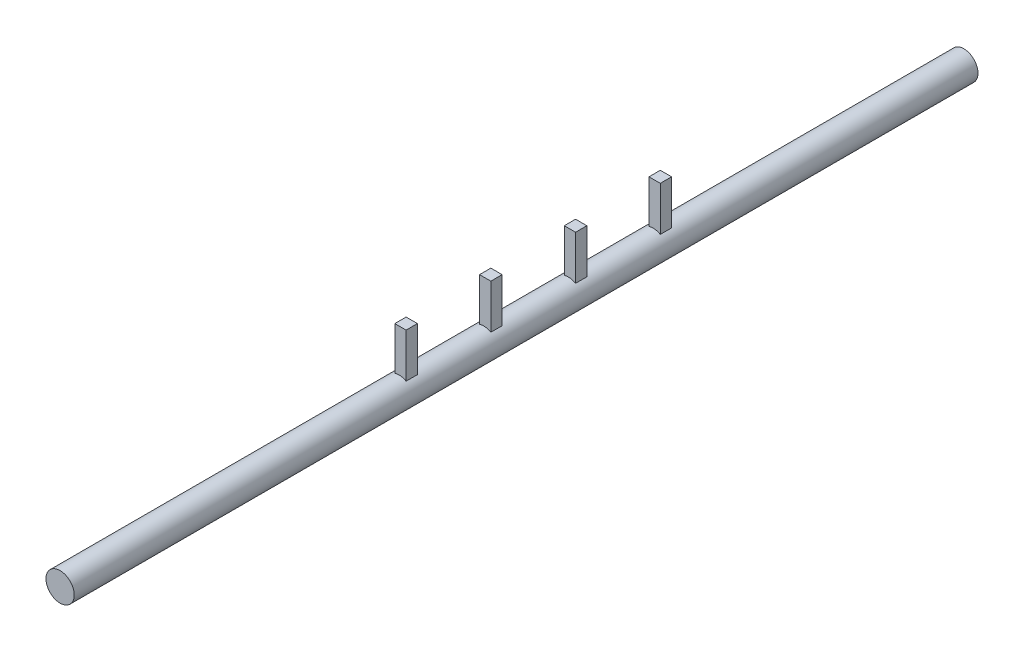
from build123d import *

# Parameters (mm, degrees)
SKETCH1_R           = 3.175
BOSS_EXTRUDE1_DEPTH = 203.2
SKETCH2_W           = 2.54
SKETCH2_H           = 2.54
BOSS_EXTRUDE2_DEPTH = 12.7


with BuildPart() as part:
    # Sketch1 → Boss-Extrude1 (new body)
    with BuildSketch(Plane.XY):
        Circle(SKETCH1_R)
    extrude(amount=BOSS_EXTRUDE1_DEPTH)

    # Sketch2 → Boss-Extrude2 (add)
    with BuildSketch(Plane(origin=(0, 0, 0), x_dir=(1, 0, 0), z_dir=(0, 1, 0))):
        with Locations((0.323252362, -106.68)):
            Rectangle(SKETCH2_W, SKETCH2_H)
        with Locations((0.323252362, -125.73)):
            Rectangle(SKETCH2_W, SKETCH2_H)
        with Locations((0.323252362, -87.63)):
            Rectangle(SKETCH2_W, SKETCH2_H)
        with Locations((0.323252362, -68.58)):
            Rectangle(SKETCH2_W, SKETCH2_H)
    extrude(amount=BOSS_EXTRUDE2_DEPTH)


solid = part.part
